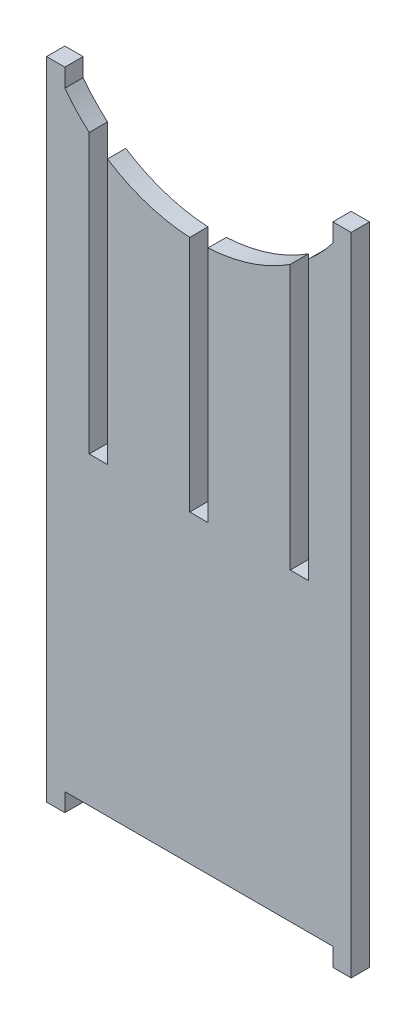
from build123d import *

# Parameters (mm, degrees)
BOSS_EXTRU_1_DEPTH      = 6
ENL_V_MAT_EXTRU_1_DEPTH = 10


with BuildPart() as part:
    # Esquisse1 → Boss.-Extru.1 (new body)
    with BuildSketch(Plane.XY):
        Polygon((-50, 0), (-50, 212), (-44, 212), (-44, 206), (-36, 206), (-36, 106), (-30, 106), (-30, 206), (-3, 206), (-3, 106), (3, 106), (3, 206), (30, 206), (30, 106), (36, 106), (36, 206), (44, 206), (44, 212), (50, 212), (50, 0), (44, 0), (44, 6), (-44, 6), (-44, 0), align=None)
    extrude(amount=BOSS_EXTRU_1_DEPTH)

    # Esquisse2 → Enlèv. mat.-Extru.1 (cut)
    with BuildSketch(Plane.XY.offset(6)):
        with BuildLine():
            Line((-44, 206), (44, 206))
            ThreePointArc((44, 206), (0, 184), (-44, 206))
        make_face()
    extrude(amount=-ENL_V_MAT_EXTRU_1_DEPTH, mode=Mode.SUBTRACT)


solid = part.part
